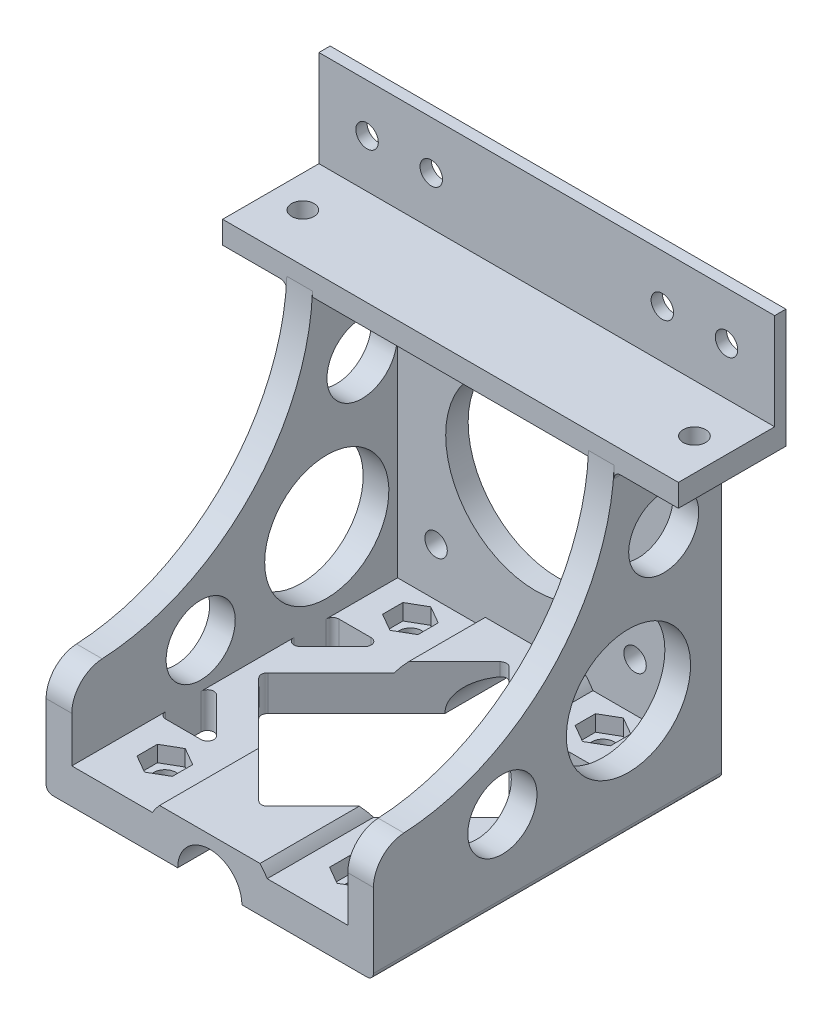
from build123d import *

# Parameters (mm, degrees)
SKETCH1_W                = 51
SKETCH1_H                = 53.5
BOSS_EXTRUDE1_DEPTH      = 54.25
SKETCH2_W                = 43
SKETCH2_H                = 43
CUT_EXTRUDE1_DEPTH       = 50.75
SKETCH3_W                = 43
SKETCH3_H                = 3.5
CUT_EXTRUDE2_DEPTH       = 37.5
CUT_EXTRUDE3_DEPTH       = 76
SKETCH5_R                = 9.673114497
SKETCH5_R_2              = 5.390775308
SKETCH5_R_3              = 5.456912487
CUT_EXTRUDE4_DEPTH       = 76
SKETCH6_R                = 14
SKETCH6_R_2              = 1.75
CUT_EXTRUDE5_DEPTH       = 76
SKETCH7_R                = 5
CUT_EXTRUDE6_DEPTH       = 76
CUT_EXTRUDE7_DEPTH       = 27
FILLET2_R                = 1
SKETCH12_R               = 1.75
CUT_EXTRUDE8_DEPTH       = 15
BOSS_EXTRUDE4_DEPTH      = 10
BOSS_EXTRUDE4_DEPTH_BACK = 61
SKETCH13_W               = 16.75
SKETCH13_H               = 3.5
SKETCH14_W               = 71
SKETCH14_H               = 1.75
BOSS_EXTRUDE5_DEPTH      = 15
SKETCH15_R               = 1.75
CUT_EXTRUDE9_DEPTH       = 10
SKETCH16_R               = 1.75
CUT_EXTRUDE10_DEPTH      = 10
CUT_EXTRUDE11_REACH      = 95.245
FILLET3_R                = 5
FILLET4_R                = 1
CUT_EXTRUDE12_DEPTH      = 2.5


with BuildPart() as part:
    # Sketch1 → Boss-Extrude1 (new body)
    with BuildSketch(Plane.XY):
        with Locations((-26.432354029, 2.021717979)):
            Rectangle(SKETCH1_W, SKETCH1_H)
    extrude(amount=BOSS_EXTRUDE1_DEPTH)

    # Sketch2 → Cut-Extrude1 (cut)
    with BuildSketch(Plane.XY.offset(54.25)):
        with Locations((-26.432354029, 3.771717979)):
            Rectangle(SKETCH2_W, SKETCH2_H)
    extrude(amount=-CUT_EXTRUDE1_DEPTH, mode=Mode.SUBTRACT)

    # Sketch3 → Cut-Extrude2 (cut)
    with BuildSketch(Plane.XY.offset(54.25)):
        with Locations((-26.432354029, 27.021717979)):
            Rectangle(SKETCH3_W, SKETCH3_H)
    extrude(amount=-CUT_EXTRUDE2_DEPTH, mode=Mode.SUBTRACT)

    # Sketch4 → Cut-Extrude3 (cut)
    with BuildSketch(Plane.ZY.offset(51.932354029)):
        with BuildLine():
            Line((16.75, 28.771717979), (54.25, 28.771717979))
            Line((54.25, 28.771717979), (54.25, -7.074674815))
            ThreePointArc((54.25, -7.074674815), (27.422353926, 2.398250742), (16.75, 28.771717979))
        make_face()
    extrude(amount=-CUT_EXTRUDE3_DEPTH, mode=Mode.SUBTRACT)

    # Sketch5 → Cut-Extrude4 (cut)
    with BuildSketch(Plane.ZY.offset(51.932354029)):
        with Locations(Location((14.525222974, -6.808047023, 0), (0, 0, 270))):
            Circle(SKETCH5_R)
        with Locations(Location((34.168969833, -12.297713654, 0), (0, 0, 270))):
            Circle(SKETCH5_R_2)
        with Locations(Location((9.035556344, 13.166402645, 0), (0, 0, 270))):
            Circle(SKETCH5_R_3)
    extrude(amount=-CUT_EXTRUDE4_DEPTH, mode=Mode.SUBTRACT)

    # Sketch6 → Cut-Extrude5 (cut)
    with BuildSketch(Plane.XY.offset(3.5)):
        with Locations((-26.432354029, 3.771717979)):
            Circle(SKETCH6_R)
        with Locations((-10.932354029, 19.271717979)):
            Circle(SKETCH6_R_2)
        with Locations((-41.932354029, 19.271717979)):
            Circle(SKETCH6_R_2)
        with Locations((-41.932354029, -11.728282021)):
            Circle(SKETCH6_R_2)
        with Locations((-10.932354029, -11.728282021)):
            Circle(SKETCH6_R_2)
    extrude(amount=-CUT_EXTRUDE5_DEPTH, mode=Mode.SUBTRACT)

    # Sketch7 → Cut-Extrude6 (cut)
    with BuildSketch(Plane(origin=(0, 0, 0), x_dir=(-1, 0, 0), z_dir=(0, 0, -1))):
        with Locations((26.432354029, -24.728282021)):
            Circle(SKETCH7_R)
    extrude(amount=-CUT_EXTRUDE6_DEPTH, mode=Mode.SUBTRACT)

    # Sketch8 → Cut-Extrude7 (cut)
    with BuildSketch(Plane.XZ.offset(24.728282021)):
        Polygon((-26.432354029, 46.625), (-6.932354029, 27.125), (-26.432354029, 7.625), (-45.932354029, 27.125), align=None)
        Polygon((-13.361286217, 40.625), (-4.932354029, 40.625), (-4.932354029, 32.196067812), align=None)
        Polygon((-4.932354029, 13.625), (-13.361286217, 13.625), (-4.932354029, 22.053932188), align=None)
        Polygon((-47.932354029, 13.625), (-39.503421841, 13.625), (-47.932354029, 22.053932188), align=None)
        Polygon((-47.932354029, 40.625), (-39.007101497, 40.625), (-47.932354029, 31.699747468), align=None)
    extrude(amount=-CUT_EXTRUDE7_DEPTH, mode=Mode.SUBTRACT)

    # Fillet2
    fillet2_edges = [part.edges().sort_by_distance(p)[0] for p in [
        (-47.932354029, -21.228282021, 31.699747468),
        (-4.932354029, -21.228282021, 32.196067812),
        (-4.932354029, -21.228282021, 22.053932188),
        (-47.932354029, -21.228282021, 22.053932188),
        (-13.361286217, -21.228282021, 13.625),
        (-39.503421841, -21.228282021, 13.625),
        (-26.432354029, -18.728282021, 7.625),
        (-4.932354029, -21.228282021, 13.625),
        (-47.932354029, -21.228282021, 13.625),
        (-45.932354029, -21.228282021, 27.125),
        (-6.932354029, -21.228282021, 27.125),
        (-4.932354029, -21.228282021, 40.625),
        (-47.932354029, -21.228282021, 40.625),
        (-39.007101497, -21.228282021, 40.625),
        (-13.361286217, -21.228282021, 40.625),
        (-26.432354029, -18.728282021, 46.625),
    ]]
    fillet(fillet2_edges, radius=FILLET2_R)

    # Sketch12 → Cut-Extrude8 (cut)
    with BuildSketch(Plane.XZ.offset(24.728282021)):
        with Locations(Location((-11.432354029, 46.25, 0), (0, 0, 270))):
            Circle(SKETCH12_R)
        with Locations(Location((-41.432354029, 46.25, 0), (0, 0, 270))):
            Circle(SKETCH12_R)
        with Locations(Location((-11.432354029, 8, 0), (0, 0, 270))):
            Circle(SKETCH12_R)
        with Locations(Location((-41.432354029, 8, 0), (0, 0, 270))):
            Circle(SKETCH12_R)
    extrude(amount=-CUT_EXTRUDE8_DEPTH, mode=Mode.SUBTRACT)

    # Sketch13 → Boss-Extrude4 (add, two sides: drawn at the far end of the back side and taken through both)
    with BuildSketch(Plane.ZY.offset(51.932354029).offset(-BOSS_EXTRUDE4_DEPTH_BACK)):
        with Locations((8.375, 27.021717979)):
            Rectangle(SKETCH13_W, SKETCH13_H)
    extrude(amount=BOSS_EXTRUDE4_DEPTH + BOSS_EXTRUDE4_DEPTH_BACK)

    # Sketch14 → Boss-Extrude5 (add)
    with BuildSketch(Plane(origin=(0, 28.771717979, 0), x_dir=(1, 0, 0), z_dir=(0, 1, 0))):
        with Locations((-26.432354029, -0.875)):
            Rectangle(SKETCH14_W, SKETCH14_H)
    extrude(amount=BOSS_EXTRUDE5_DEPTH)

    # Sketch15 → Cut-Extrude9 (cut)
    with BuildSketch(Plane.XZ.offset(-25.271717979)):
        with Locations((-56.932354029, 9.25)):
            Circle(SKETCH15_R)
        with Locations((4.067645971, 9.25)):
            Circle(SKETCH15_R)
    extrude(amount=-CUT_EXTRUDE9_DEPTH, mode=Mode.SUBTRACT)

    # Sketch16 → Cut-Extrude10 (cut)
    with BuildSketch(Plane(origin=(0, 0, 0), x_dir=(-1, 0, 0), z_dir=(0, 0, -1))):
        with Locations((54.432354029, 36.271717979)):
            Circle(SKETCH16_R)
        with Locations((-1.567645971, 36.271717979)):
            Circle(SKETCH16_R)
        with Locations((44.432354029, 36.271717979)):
            Circle(SKETCH16_R)
        with Locations((8.432354029, 36.271717979)):
            Circle(SKETCH16_R)
    extrude(amount=-CUT_EXTRUDE10_DEPTH, mode=Mode.SUBTRACT)

    # Cut-Extrude11: up to this face of the body (flat: up to its plane)
    cut_extrude11_end = Plane(part.part.faces().sort_by_distance((-26.432354029, -17.120170189, 3.5))[0])
    # Sketch17 → Cut-Extrude11 (cut, up to the picked face)
    with BuildSketch(Plane.XY.offset(54.25), mode=Mode.PRIVATE) as cut_extrude11_sk1:
        with BuildLine():
            Line((-17.488082119, -19.228282021), (-4.932354029, -19.228282021))
            Line((-4.932354029, -19.228282021), (-4.932354029, -17.728282021))
            Line((-4.932354029, -17.728282021), (-18.606116108, -17.728282021))
            ThreePointArc((-18.606116108, -17.728282021), (-18.013624909, -18.453331822), (-17.488082119, -19.228282021))
        make_face()
    cut_extrude11_tool1 = split(extrude(cut_extrude11_sk1.sketch, amount=-CUT_EXTRUDE11_REACH, mode=Mode.PRIVATE), bisect_by=cut_extrude11_end, keep=Keep.BOTH, mode=Mode.PRIVATE)
    # Sketch17 → Cut-Extrude11 (cut, up to the picked face)
    with BuildSketch(Plane.XY.offset(54.25), mode=Mode.PRIVATE) as cut_extrude11_sk2:
        with BuildLine():
            Line((-35.376625939, -19.228282021), (-47.932354029, -19.228282021))
            Line((-47.932354029, -19.228282021), (-47.932354029, -17.728282021))
            Line((-47.932354029, -17.728282021), (-34.25859195, -17.728282021))
            ThreePointArc((-34.25859195, -17.728282021), (-34.851083149, -18.453331822), (-35.376625939, -19.228282021))
        make_face()
    cut_extrude11_tool2 = split(extrude(cut_extrude11_sk2.sketch, amount=-CUT_EXTRUDE11_REACH, mode=Mode.PRIVATE), bisect_by=cut_extrude11_end, keep=Keep.BOTH, mode=Mode.PRIVATE)
    add(cut_extrude11_tool1.solids().sort_by(Axis((-11.476334, -18.467624, 54.25), (0, 0, -1)))[0], mode=Mode.SUBTRACT)
    add(cut_extrude11_tool2.solids().sort_by(Axis((-41.388374, -18.467624, 54.25), (0, 0, -1)))[0], mode=Mode.SUBTRACT)

    # Fillet3
    fillet3_edges = [part.edges().sort_by_distance(p)[0] for p in [
        (-2.932354029, -7.074674815, 54.25),
        (-49.932354029, -7.074674815, 54.25),
    ]]
    fillet(fillet3_edges, radius=FILLET3_R)

    # Fillet4
    fillet4_edges = [part.edges().sort_by_distance(p)[0] for p in [
        (-51.932354029, 25.271717979, 8.375),
        (-0.932354029, 25.271717979, 8.375),
        (-0.932354029, -24.728282021, 27.125),
        (-51.932354029, -24.728282021, 27.125),
    ]]
    fillet(fillet4_edges, radius=FILLET4_R)

    # Sketch19 → Cut-Extrude12 (cut)
    with BuildSketch(Plane(origin=(0, -19.228282021, 0), x_dir=(1, 0, 0), z_dir=(0, 1, 0))):
        Polygon((-44.182354029, -9.58771324), (-41.432354029, -11.175426481), (-38.682354029, -9.58771324), (-38.682354029, -6.41228676), (-41.432354029, -4.824573519), (-44.182354029, -6.41228676), align=None)
        Polygon((-11.432354029, -4.824573519), (-14.182354029, -6.41228676), (-14.182354029, -9.58771324), (-11.432354029, -11.175426481), (-8.682354029, -9.58771324), (-8.682354029, -6.41228676), align=None)
        Polygon((-38.682354029, -47.83771324), (-38.682354029, -44.66228676), (-41.432354029, -43.074573519), (-44.182354029, -44.66228676), (-44.182354029, -47.83771324), (-41.432354029, -49.425426481), align=None)
        Polygon((-8.682354029, -47.83771324), (-8.682354029, -44.66228676), (-11.432354029, -43.074573519), (-14.182354029, -44.66228676), (-14.182354029, -47.83771324), (-11.432354029, -49.425426481), align=None)
    extrude(amount=-CUT_EXTRUDE12_DEPTH, mode=Mode.SUBTRACT)


solid = part.part
